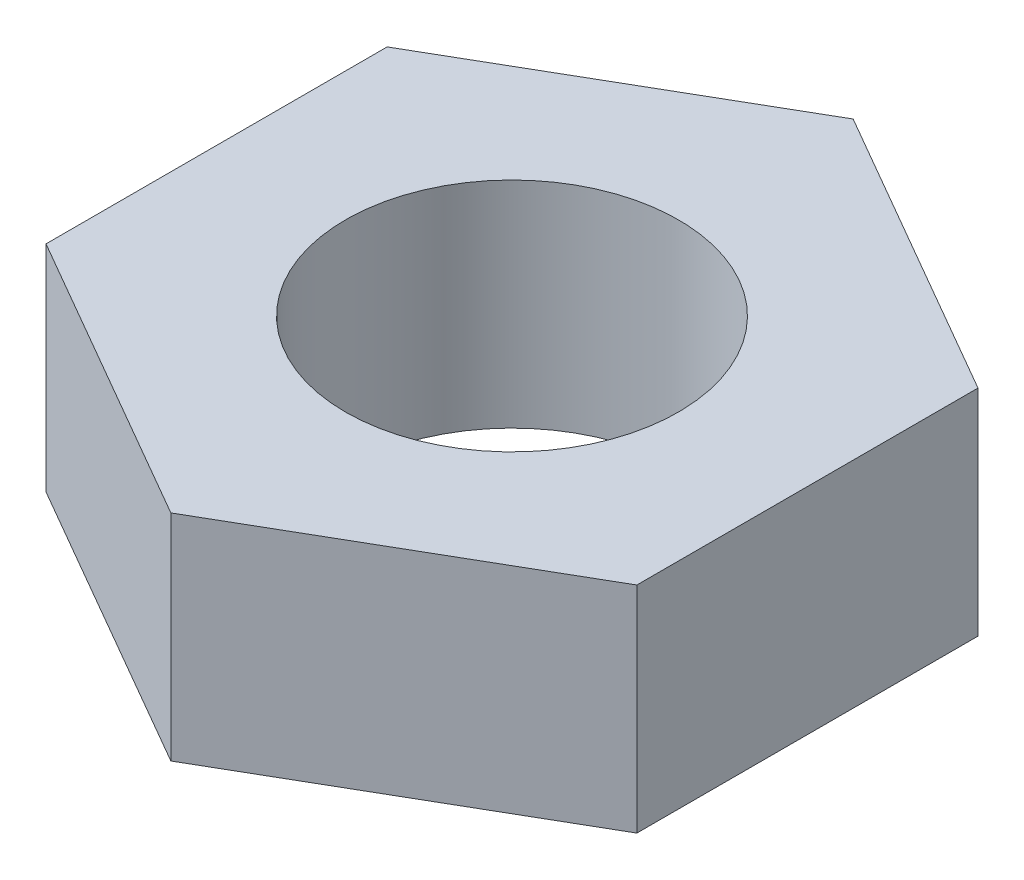
from build123d import *

# Parameters (mm, degrees)
SKETCH1_R           = 1.55
BOSS_EXTRUDE1_DEPTH = 2


with BuildPart() as part:
    # Sketch1 → Boss-Extrude1 (new body)
    with BuildSketch(Plane(origin=(0, 0, 0), x_dir=(1, 0, 0), z_dir=(0, 1, 0))):
        Polygon((0, 3.175426481), (-2.75, 1.58771324), (-2.75, -1.58771324), (0, -3.175426481), (2.75, -1.58771324), (2.75, 1.58771324), align=None)
        with Locations(Location((0, 0, 0), (0, 0, 270))):
            Circle(SKETCH1_R, mode=Mode.SUBTRACT)
    extrude(amount=BOSS_EXTRUDE1_DEPTH)


solid = part.part
